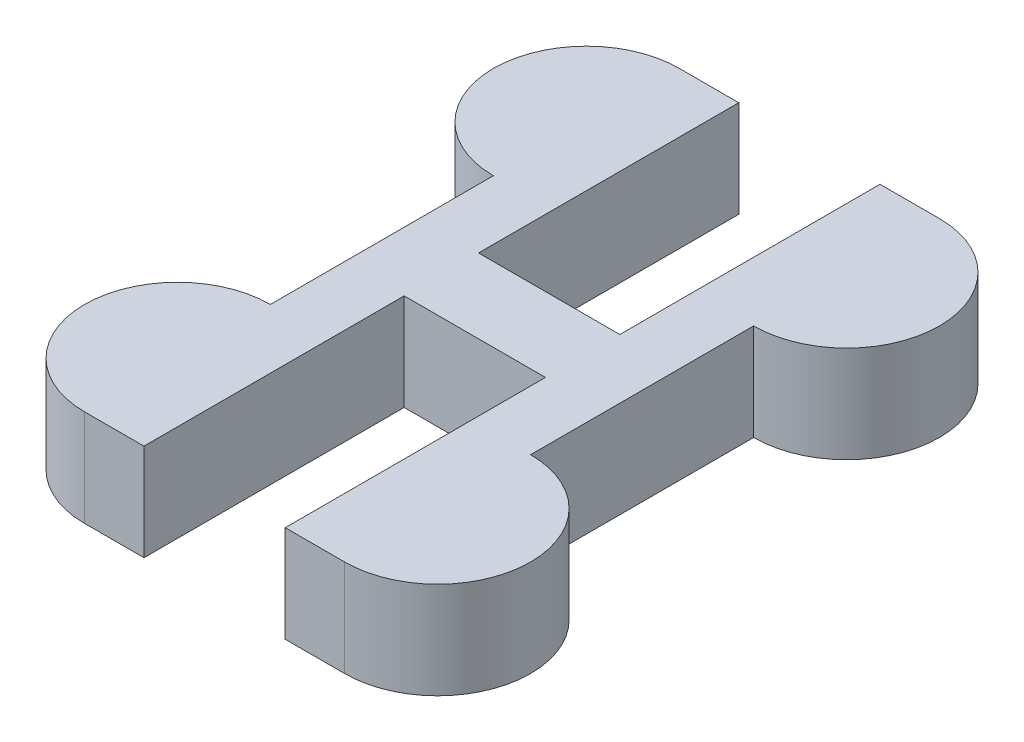
from build123d import *

# Parameters (mm, degrees)
BOSS_EXTRUDE1_DEPTH = 1.3


with BuildPart() as part:
    # Sketch1 → Boss-Extrude1 (new body)
    with BuildSketch(Plane(origin=(0, 0, 0), x_dir=(1, 0, 0), z_dir=(0, 1, 0))):
        with BuildLine():
            Line((-0.95, 4), (-0.95, 0.5))
            Line((-0.95, 0.5), (0.95, 0.5))
            Line((0.95, 0.5), (0.95, 4))
            Line((0.95, 4), (1.75, 4))
            ThreePointArc((1.75, 4), (3, 2.75), (1.75, 1.5))
            Line((1.75, 1.5), (1.75, -1.5))
            ThreePointArc((1.75, -1.5), (3, -2.75), (1.75, -4))
            Line((1.75, -4), (0.95, -4))
            Line((0.95, -4), (0.95, -0.5))
            Line((0.95, -0.5), (-0.95, -0.5))
            Line((-0.95, -0.5), (-0.95, -4))
            Line((-0.95, -4), (-1.75, -4))
            ThreePointArc((-1.75, -4), (-3, -2.75), (-1.75, -1.5))
            Line((-1.75, -1.5), (-1.75, 1.5))
            ThreePointArc((-1.75, 1.5), (-3, 2.75), (-1.75, 4))
            Line((-1.75, 4), (-0.95, 4))
        make_face()
    extrude(amount=BOSS_EXTRUDE1_DEPTH)


solid = part.part
